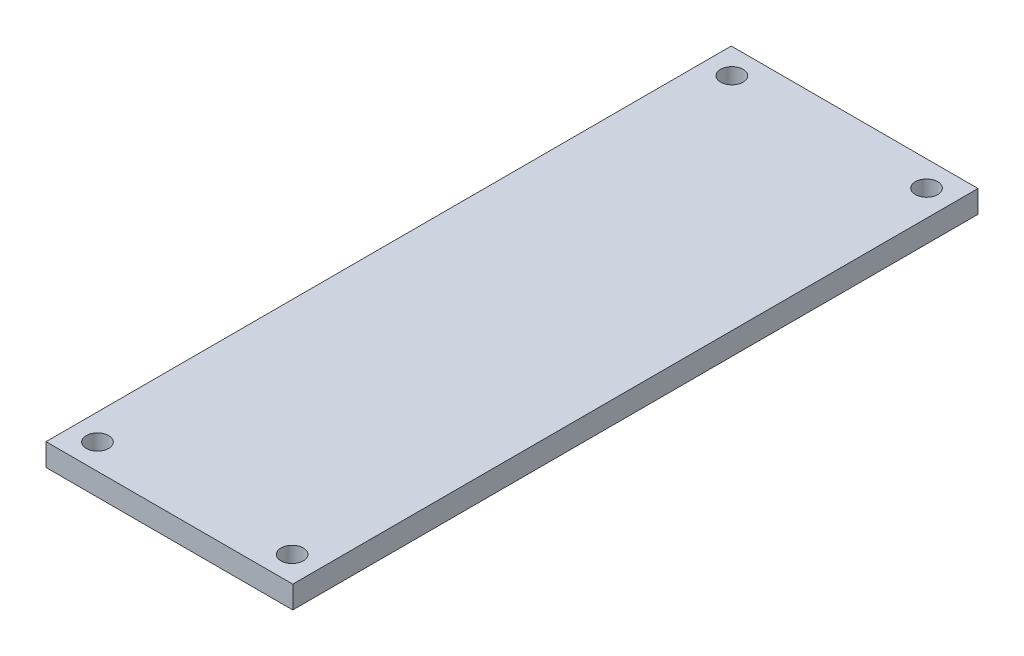
from build123d import *

# Parameters (mm, degrees)
SKETCH_1_W          = 33.05
SKETCH_1_H          = 91.78
EXTRUDE_1_DEPTH     = 3
SKETCH_2_R          = 1.5
CUT_EXTRUDE_1_DEPTH = 36.82


with BuildPart() as part:
    # 草图1 → 凸台-拉伸1 (new body)
    with BuildSketch(Plane(origin=(0, 0, 0), x_dir=(1, 0, 0), z_dir=(0, 1, 0))):
        Rectangle(SKETCH_1_W, SKETCH_1_H)
    extrude(amount=EXTRUDE_1_DEPTH)

    # 草图2 → 切除-拉伸1 (cut)
    with BuildSketch(Plane(origin=(0, 3, 0), x_dir=(1, 0, 0), z_dir=(0, 1, 0))):
        with Locations(Location((13.037686279, -42.48561498, 0), (0, 0, 270))):
            Circle(SKETCH_2_R)
        with Locations(Location((-13.037686279, -42.48561498, 0), (0, 0, 270))):
            Circle(SKETCH_2_R)
        with Locations(Location((-13.037686279, 42.48561498, 0), (0, 0, 270))):
            Circle(SKETCH_2_R)
        with Locations(Location((13.037686279, 42.48561498, 0), (0, 0, 270))):
            Circle(SKETCH_2_R)
    extrude(amount=-CUT_EXTRUDE_1_DEPTH, mode=Mode.SUBTRACT)


solid = part.part
